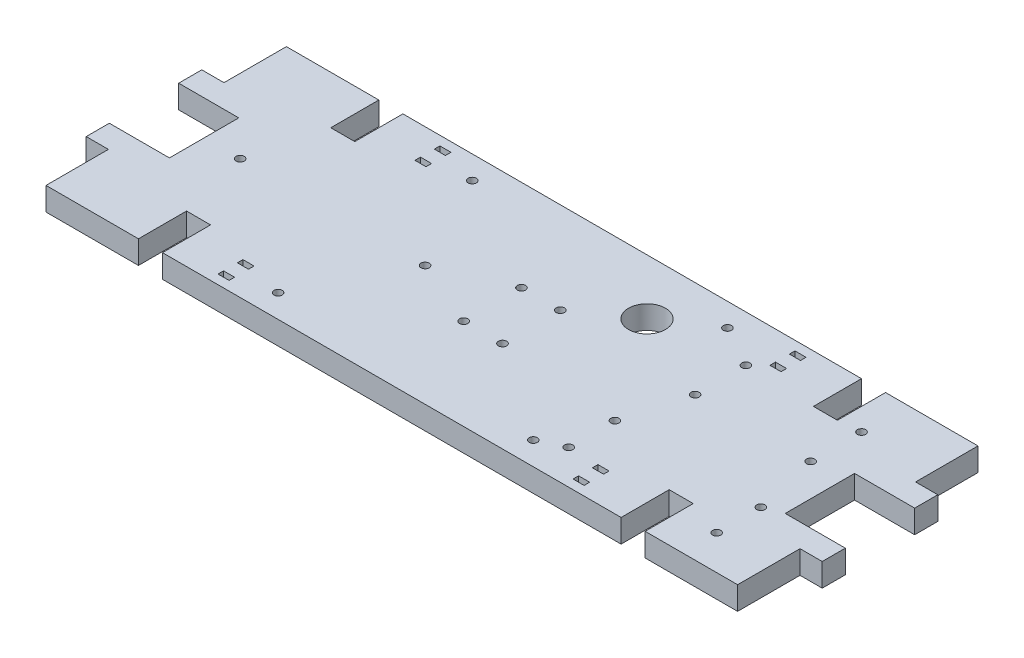
from build123d import *

# Parameters (mm, degrees)
BOSS_EXTRUDE1_DEPTH = 6.35
SKETCH2_R           = 1.1303
CUT_EXTRUDE1_DEPTH  = 10.16
SKETCH3_R           = 5.08
SKETCH3_W           = 3.048
SKETCH3_H           = 1.524
CUT_EXTRUDE2_DEPTH  = 10.16
SKETCH4_R           = 1.1303
CUT_EXTRUDE3_DEPTH  = 10.16
SKETCH5_W           = 16.51
SKETCH5_H           = 19.05
CUT_EXTRUDE4_DEPTH  = 10.16


with BuildPart() as part:
    # Sketch1 → Boss-Extrude1 (new body)
    with BuildSketch(Plane(origin=(0, 0, 0), x_dir=(1, 0, 0), z_dir=(0, 1, 0))):
        Polygon((-95.504, 15.875), (-101.6, 15.875), (-101.6, -15.875), (-95.504, -15.875), (-95.504, -33.02), (-70.104, -33.02), (-70.104, -19.812), (-63.5, -19.812), (-63.5, -33.02), (2.794, -33.02), (9.398, -33.02), (62.484, -33.02), (62.484, -19.812), (69.088, -19.812), (69.088, -33.02), (94.488, -33.02), (94.488, -15.875), (100.584, -15.875), (100.584, 15.875), (94.488, 15.875), (94.488, 33.02), (69.088, 33.02), (69.088, 19.812), (62.484, 19.812), (62.484, 33.02), (9.398, 33.02), (2.794, 33.02), (-63.5, 33.02), (-63.5, 19.812), (-70.104, 19.812), (-70.104, 33.02), (-95.504, 33.02), align=None)
    extrude(amount=BOSS_EXTRUDE1_DEPTH)

    # Sketch2 → Cut-Extrude1 (cut)
    with BuildSketch(Plane(origin=(0, 6.35, 0), x_dir=(1, 0, 0), z_dir=(0, 1, 0))):
        with Locations(Location((-5.842, 7.9375, 0), (0, 0, 270))):
            Circle(SKETCH2_R)
        with Locations(Location((4.826, 7.9375, 0), (0, 0, 270))):
            Circle(SKETCH2_R)
        with Locations(Location((4.826, -7.9375, 0), (0, 0, 270))):
            Circle(SKETCH2_R)
        with Locations(Location((-5.842, -7.9375, 0), (0, 0, 270))):
            Circle(SKETCH2_R)
        with Locations(Location((-75.184, 0, 0), (0, 0, 270))):
            Circle(SKETCH2_R)
        with Locations(Location((-24.384, 0, 0), (0, 0, 270))):
            Circle(SKETCH2_R)
        with Locations(Location((43.434, 20.32, 0), (0, 0, 270))):
            Circle(SKETCH2_R)
        with Locations(Location((75.184, 20.32, 0), (0, 0, 270))):
            Circle(SKETCH2_R)
        with Locations(Location((75.184, 6.35, 0), (0, 0, 270))):
            Circle(SKETCH2_R)
        with Locations(Location((43.434, 6.35, 0), (0, 0, 270))):
            Circle(SKETCH2_R)
        with Locations(Location((38.608, -10.839373847, 0), (0, 0, 270))):
            Circle(SKETCH2_R)
        with Locations(Location((79.248, -11.389700319, 0), (0, 0, 270))):
            Circle(SKETCH2_R)
        with Locations(Location((38.608, -23.539373847, 0), (0, 0, 270))):
            Circle(SKETCH2_R)
        with Locations(Location((79.248, -23.539373847, 0), (0, 0, 270))):
            Circle(SKETCH2_R)
    extrude(amount=-CUT_EXTRUDE1_DEPTH, mode=Mode.SUBTRACT)

    # Sketch3 → Cut-Extrude2 (cut)
    with BuildSketch(Plane(origin=(0, 6.35, 0), x_dir=(1, 0, 0), z_dir=(0, 1, 0))):
        with Locations(Location((18.796, 17.78, 0), (0, 0, 270))):
            Circle(SKETCH3_R)
        with Locations((-49.276, 29.718)):
            Rectangle(SKETCH3_W, SKETCH3_H)
        with Locations((-49.276, 24.384)):
            Rectangle(SKETCH3_W, SKETCH3_H)
        with Locations((48.26, 29.718)):
            Rectangle(SKETCH3_W, SKETCH3_H)
        with Locations((48.26, 24.384)):
            Rectangle(SKETCH3_W, SKETCH3_H)
        with Locations((-49.276, -24.384)):
            Rectangle(SKETCH3_W, SKETCH3_H)
        with Locations((-49.276, -29.718)):
            Rectangle(SKETCH3_W, SKETCH3_H)
        with Locations((48.26, -24.384)):
            Rectangle(SKETCH3_W, SKETCH3_H)
        with Locations((48.26, -29.718)):
            Rectangle(SKETCH3_W, SKETCH3_H)
    extrude(amount=-CUT_EXTRUDE2_DEPTH, mode=Mode.SUBTRACT)

    # Sketch4 → Cut-Extrude3 (cut)
    with BuildSketch(Plane(origin=(0, 6.35, 0), x_dir=(1, 0, 0), z_dir=(0, 1, 0))):
        with Locations(Location((-38.1, 26.67, 0), (0, 0, 270))):
            Circle(SKETCH4_R)
        with Locations(Location((32.004, 26.67, 0), (0, 0, 270))):
            Circle(SKETCH4_R)
        with Locations(Location((-38.1, -26.67, 0), (0, 0, 270))):
            Circle(SKETCH4_R)
        with Locations(Location((32.004, -26.67, 0), (0, 0, 270))):
            Circle(SKETCH4_R)
    extrude(amount=-CUT_EXTRUDE3_DEPTH, mode=Mode.SUBTRACT)

    # Sketch5 → Cut-Extrude4 (cut)
    with BuildSketch(Plane(origin=(0, 6.35, 0), x_dir=(1, 0, 0), z_dir=(0, 1, 0))):
        with Locations((-93.345, 0)):
            Rectangle(SKETCH5_W, SKETCH5_H)
        with Locations((92.329, 0)):
            Rectangle(SKETCH5_W, SKETCH5_H)
    extrude(amount=-CUT_EXTRUDE4_DEPTH, mode=Mode.SUBTRACT)


solid = part.part
